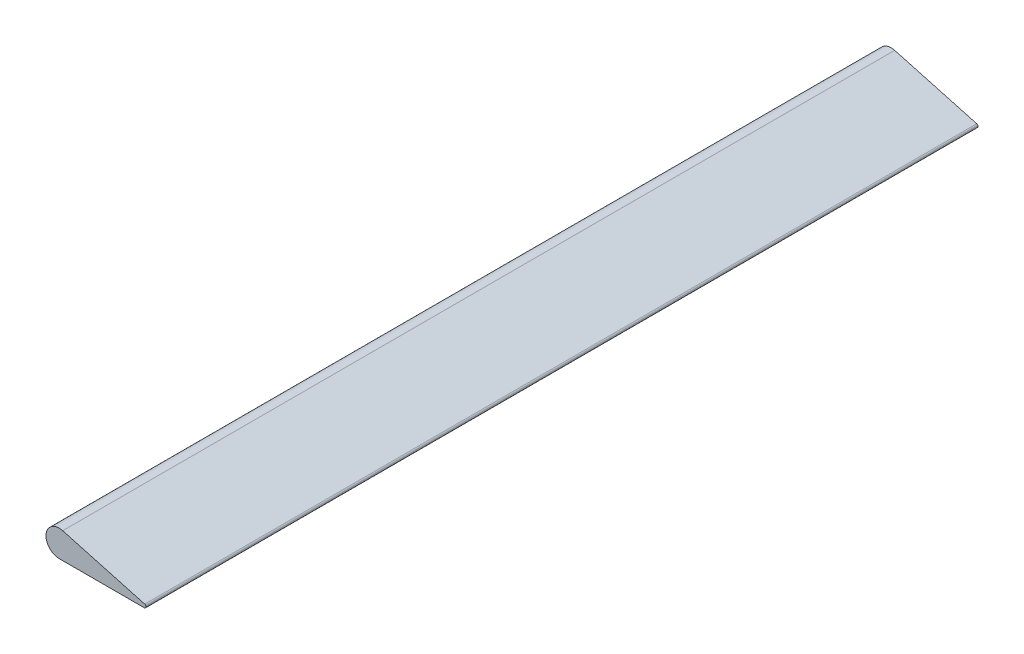
from build123d import *

# Parameters (mm, degrees)
BOSS_EXTRUDE1_DEPTH = 238
SKETCH3_W           = 15
SKETCH3_H           = 15
CUT_EXTRUDE1_DEPTH  = 54
FILLET1_R           = 0.5
FILLET2_R           = 3


with BuildPart() as part:
    # Sketch2 → Boss-Extrude1 (new body)
    with BuildSketch(Plane.XY.offset(-3)):
        with BuildLine():
            Line((446.391965645, 20.11245238), (474.43313548, 20.11245238))
            Line((474.43313548, 20.11245238), (447.390900992, 27.530319971))
            ThreePointArc((447.390900992, 27.530319971), (442.649552271, 24.39262378), (446.391965645, 20.11245238))
        make_face()
    extrude(amount=BOSS_EXTRUDE1_DEPTH)

    # Sketch3 → Cut-Extrude1 (cut)
    with BuildSketch(Plane.XZ.offset(30.589717262)):
        with Locations((450.115770482, 182.5)):
            Rectangle(SKETCH3_W, SKETCH3_H)
        with Locations((450.115770482, 49.5)):
            Rectangle(SKETCH3_W, SKETCH3_H)
    extrude(amount=-CUT_EXTRUDE1_DEPTH, mode=Mode.SUBTRACT)

    # Fillet1
    fillet1_edges = [part.edges().sort_by_distance(p)[0] for p in [
        (474.43313548, 20.11245238, 116),
    ]]
    fillet(fillet1_edges, radius=FILLET1_R)

    # Fillet2
    fillet2_edges = [part.edges().sort_by_distance(p)[0] for p in [
        (457.615770482, 21.761367559, 190),
        (457.615770482, 21.761367559, 175),
        (457.615770482, 21.761367559, 57),
        (457.615770482, 21.761367559, 42),
    ]]
    fillet(fillet2_edges, radius=FILLET2_R)


solid = part.part
